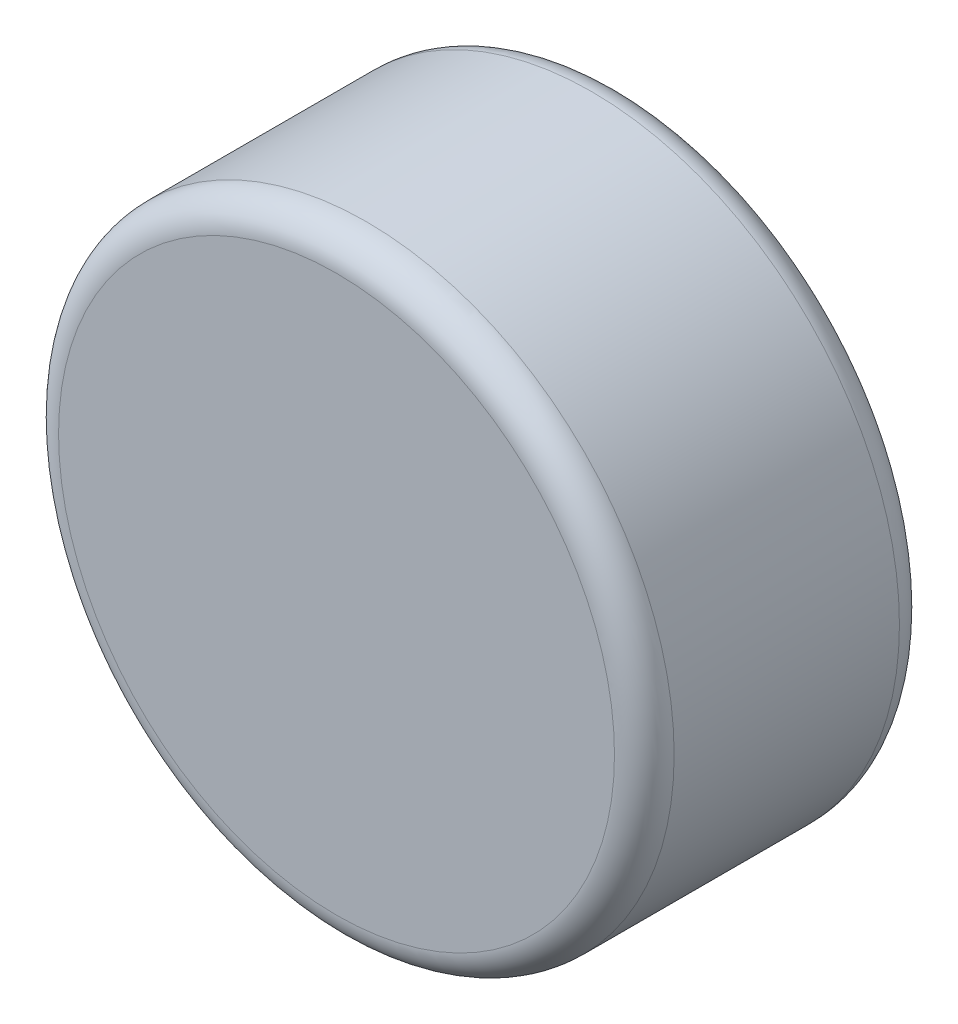
from build123d import *

# Parameters (mm, degrees)
SKETCH1_W          = 48.5
SKETCH1_H          = 44.9
SKETCH2_R          = 4.125
CUT_EXTRUDE1_DEPTH = 26.4
FILLET1_R          = 4.7


with BuildPart() as part:
    # Sketch1 → Revolve1 (revolve)
    with BuildSketch(Plane(origin=(0, 0, 0), x_dir=(1, 0, 0), z_dir=(0, 1, 0))):
        with Locations((24.25, 22.45)):
            Rectangle(SKETCH1_W, SKETCH1_H)
    revolve(axis=Axis((0, 0, 0), (0, 0, -1)))

    # Sketch2 → Cut-Extrude1 (cut)
    with BuildSketch(Plane(origin=(0, 0, -44.9), x_dir=(-1, 0, 0), z_dir=(0, 0, -1))):
        Circle(SKETCH2_R)
    extrude(amount=-CUT_EXTRUDE1_DEPTH, mode=Mode.SUBTRACT)

    # Fillet1
    fillet1_edges = [part.edges().sort_by_distance(p)[0] for p in [
        (-48.5, 0, -44.9),
        (-48.5, 0, 0),
    ]]
    fillet(fillet1_edges, radius=FILLET1_R)


solid = part.part
